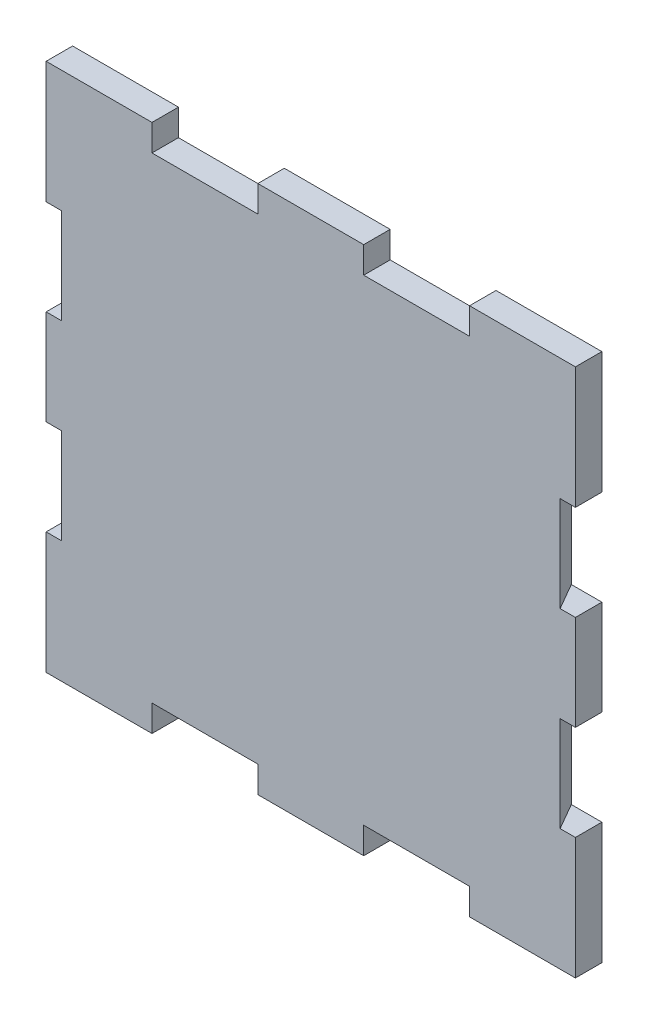
from build123d import *

# Parameters (mm, degrees)
ESQUISSE1_W             = 100
ESQUISSE1_H             = 100
BOSS_EXTRU_1_DEPTH      = 5
ESQUISSE2_W             = 20
ESQUISSE2_H             = 5
ENL_V_MAT_EXTRU_1_DEPTH = 142.509716981
ESQUISSE3_W             = 2.886751346
ESQUISSE3_H             = 18
ENL_V_MAT_EXTRU_2_DEPTH = 142.509716981
ENL_V_MAT_EXTRU_5_DEPTH = 18
ENL_V_MAT_EXTRU_6_DEPTH = 18
ENL_V_MAT_EXTRU_7_DEPTH = 18
ENL_V_MAT_EXTRU_8_DEPTH = 18


with BuildPart() as part:
    # Esquisse1 → Boss.-Extru.1 (new body)
    with BuildSketch(Plane.XY):
        with Locations((-50, -50)):
            Rectangle(ESQUISSE1_W, ESQUISSE1_H)
    extrude(amount=BOSS_EXTRU_1_DEPTH)

    # Esquisse2 → Enlèv. mat.-Extru.1 (cut, through all)
    with BuildSketch(Plane.XY.offset(5)):
        with Locations((-70, -2.5)):
            Rectangle(ESQUISSE2_W, ESQUISSE2_H)
        with Locations((-30, -2.5)):
            Rectangle(ESQUISSE2_W, ESQUISSE2_H)
        with Locations((-30, -97.5)):
            Rectangle(ESQUISSE2_W, ESQUISSE2_H)
        with Locations((-70, -97.5)):
            Rectangle(ESQUISSE2_W, ESQUISSE2_H)
    extrude(amount=-ENL_V_MAT_EXTRU_1_DEPTH, mode=Mode.SUBTRACT)

    # Esquisse3 → Enlèv. mat.-Extru.2 (cut, through all)
    with BuildSketch(Plane.XY.offset(5)):
        with Locations((-98.556624327, -32)):
            Rectangle(ESQUISSE3_W, ESQUISSE3_H)
        with Locations((-98.556624327, -68)):
            Rectangle(ESQUISSE3_W, ESQUISSE3_H)
        with Locations((-1.443375673, -68)):
            Rectangle(ESQUISSE3_W, ESQUISSE3_H)
        with Locations((-1.443375673, -32)):
            Rectangle(ESQUISSE3_W, ESQUISSE3_H)
    extrude(amount=-ENL_V_MAT_EXTRU_2_DEPTH, mode=Mode.SUBTRACT)

    # Esquisse5 → Enlèv. mat.-Extru.5 (cut)
    with BuildSketch(Plane.XZ.offset(59)):
        Polygon((-97.113248654, 0), (-97.113248654, 5), (-94.226497308, 0), align=None)
    extrude(amount=ENL_V_MAT_EXTRU_5_DEPTH, mode=Mode.SUBTRACT)

    # Esquisse6 → Enlèv. mat.-Extru.6 (cut)
    with BuildSketch(Plane(origin=(0, -41, 0), x_dir=(1, 0, 0), z_dir=(0, 1, 0))):
        Polygon((-97.113248654, 0), (-97.113248654, -5), (-94.226497308, 0), align=None)
    extrude(amount=ENL_V_MAT_EXTRU_6_DEPTH, mode=Mode.SUBTRACT)

    # Esquisse7 → Enlèv. mat.-Extru.7 (cut)
    with BuildSketch(Plane.XZ.offset(59)):
        Polygon((-2.886751346, 0), (-2.886751346, 5), (-5.773502692, 0), align=None)
    extrude(amount=ENL_V_MAT_EXTRU_7_DEPTH, mode=Mode.SUBTRACT)

    # Esquisse8 → Enlèv. mat.-Extru.8 (cut)
    with BuildSketch(Plane.XZ.offset(23)):
        Polygon((-2.886751346, 0), (-2.886751346, 5), (-5.773502692, 0), align=None)
    extrude(amount=ENL_V_MAT_EXTRU_8_DEPTH, mode=Mode.SUBTRACT)


solid = part.part
